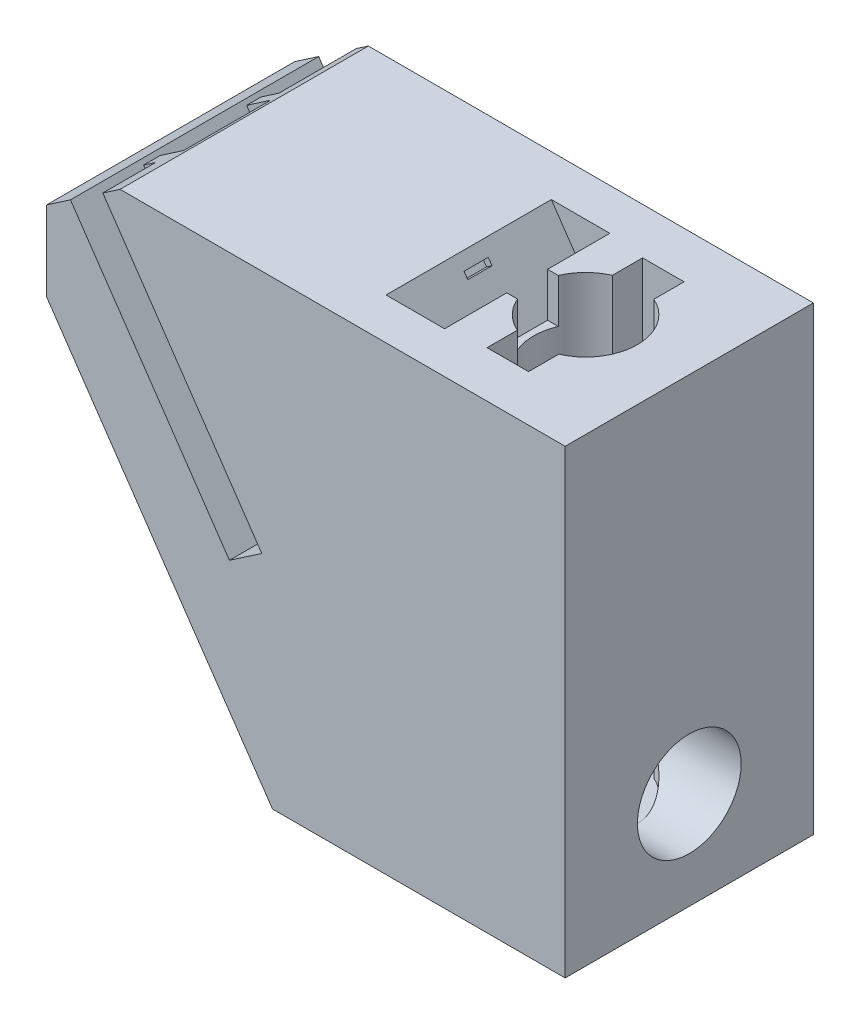
from build123d import *
from build123d.topology import SkipClean

# Parameters (mm, degrees)
BOSS_EXTRUDE1_DEPTH     = 2.5
BOSS_EXTRUDE1_2_DEPTH   = 2.5
BOSS_EXTRUDE2_DEPTH     = 6.35
BOSS_EXTRUDE3_DEPTH     = 6.35
SKETCH4_R               = 3.175
CUT_EXTRUDE1_DEPTH      = 25.4
SKETCH5_R               = 1.5875
CUT_EXTRUDE2_DEPTH      = 25.4
CUT_EXTRUDE3_DEPTH      = 25.4
CUT_EXTRUDE4_REACH      = 43
CUT_EXTRUDE4_END_RADIUS = 3.175
CUT_EXTRUDE5_REACH      = 39.36
SKETCH8_W               = 2.54
SKETCH8_H               = 9.525
SKETCH9_W               = 0.7112
SKETCH9_H               = 15.2
BOSS_EXTRUDE4_DEPTH     = 17
BOSS_EXTRUDE5_DEPTH     = 1.016
SKETCH11_W              = 1.176658287
SKETCH11_H              = 2.5
SKETCH11_W_2            = 2.636987944
SKETCH11_H_2            = 15.2
BOSS_EXTRUDE6_DEPTH     = 1.27
CUT_EXTRUDE6_DEPTH      = 38.864332241
BOSS_EXTRUDE7_START     = 2.54
BOSS_EXTRUDE7_DEPTH     = 2.54
BOSS_EXTRUDE8_DEPTH     = 2.54
BOSS_EXTRUDE9_DEPTH     = 0.508
BOSS_EXTRUDE10_DEPTH    = 0.508
CUT_EXTRUDE7_DEPTH      = 3.81
CUT_EXTRUDE8_DEPTH      = 3.81
BOSS_EXTRUDE11_DEPTH    = 3.81


with BuildPart() as part:
    # Sketch1 → Boss-Extrude1 (new body)
    with BuildSketch(Plane.XY):
        Polygon((5.08, 0), (0, 0), (0, 19.141079028), (-1.033059908, 19.141079028), (-3.75575709, 23.125698967), (-8.376397661, 9.077684872), (-11.679025045, 6.820994294), (-21.26996, 20.857160675), (-22.86, 19.770683798), (-22.86, -3.81), (8.89, -3.81), (8.89, 24.384), (5.08, 24.384), align=None)
    extrude(amount=BOSS_EXTRUDE1_DEPTH)



with BuildPart() as body_2:
    # Sketch1 → Boss-Extrude1 2 (new body)
    with BuildSketch(Plane.XY):
        Polygon((-10.069369191, 23.749), (-4.328956497, 23.964566322), (-4.615556201, 24.384), (-16.108492032, 24.384), (-17.03780348, 23.749), align=None)
    extrude(amount=BOSS_EXTRUDE1_2_DEPTH)


with BuildPart() as part_1:
    add(part.part)

    add(body_2.part)  # Boss-Extrude2 merges body 2
    # Sketch2 → Boss-Extrude2 (add)
    with BuildSketch(Plane.XY.offset(2.5)):
        Polygon((-11.679025045, 6.820994294), (-21.26996, 20.857160675), (-22.86, 19.770683798), (-22.86, -3.81), (8.89, -3.81), (8.89, 24.384), (5.08, 24.384), (5.08, 0), (0, 0), (0, 19.141079028), (-1.033059908, 19.141079028), (-3.75575709, 23.125698967), (-8.376397661, 9.077684872), align=None)
        Polygon((-16.108492032, 24.384), (-18.00931945, 23.085161582), (-8.418384495, 9.048995201), (-8.376397661, 9.077684872), (-3.75575709, 23.125698967), (-1.033059908, 19.141079028), (0, 19.141079028), (0, 0), (5.08, 0), (5.08, 24.384), align=None)
    extrude(amount=BOSS_EXTRUDE2_DEPTH)

    # Sketch3 → Boss-Extrude3 (add)
    with BuildSketch(Plane(origin=(0, 0, 0), x_dir=(-1, 0, 0), z_dir=(0, 0, -1))):
        Polygon((-8.89, 24.384), (-8.89, -3.81), (22.86, -3.81), (22.86, 19.770683798), (21.26996, 20.857160675), (11.679025045, 6.820994294), (8.376397661, 9.077684872), (18.00931945, 23.085161582), (16.108492032, 24.384), align=None)
    extrude(amount=BOSS_EXTRUDE3_DEPTH)

    # Sketch4 → Cut-Extrude1 (cut)
    with BuildSketch(Plane(origin=(0, 24.384, 0), x_dir=(1, 0, 0), z_dir=(0, 1, 0))):
        with Locations(Location((2.54, -1.25, 0), (0, 0, 270))):
            Circle(SKETCH4_R)
    extrude(amount=-CUT_EXTRUDE1_DEPTH, mode=Mode.SUBTRACT)

    # Sketch5 → Cut-Extrude2 (cut)
    with BuildSketch(Plane(origin=(0, -1.016, 0), x_dir=(1, 0, 0), z_dir=(0, 1, 0))):
        with Locations(Location((2.54, -1.25, 0), (0, 0, 270))):
            Circle(SKETCH5_R)
    extrude(amount=-CUT_EXTRUDE2_DEPTH, mode=Mode.SUBTRACT)

    # Sketch6 → Cut-Extrude3 (cut)
    with BuildSketch(Plane.XY.offset(8.85)):
        Polygon((-22.86, 16.430904611), (-9.029357481, -3.81), (-22.86, -3.81), align=None)
    extrude(amount=-CUT_EXTRUDE3_DEPTH, mode=Mode.SUBTRACT)

    # Cut-Extrude4: up to this cylinder (the profile starts outside it)
    with SkipClean():  # the faces are left unmerged after this step: merging them gives an invalid solid
        cut_extrude4_end = Plane(origin=(2.54, 2.159, 1.25), z_dir=(0, 1, 0)) * Cylinder(CUT_EXTRUDE4_END_RADIUS, 96.045024, mode=Mode.PRIVATE)
        # Sketch7 → Cut-Extrude4 (cut, up to the surface)
        with BuildSketch(Plane(origin=(8.89, 0, 0), x_dir=(0, 0, -1), z_dir=(1, 0, 0)), mode=Mode.PRIVATE) as cut_extrude4_sk1:
            with BuildLine():
                ThreePointArc((1.925, 2.159), (-1.25, 5.334), (-4.425, 2.159))
                Line((-4.425, 2.159), (1.925, 2.159))
            make_face()
        cut_extrude4_tool1 = extrude(cut_extrude4_sk1.sketch, amount=-CUT_EXTRUDE4_REACH, mode=Mode.PRIVATE) - cut_extrude4_end
        add(cut_extrude4_tool1.solids().sort_by_distance((8.89, 3.506512, 1.25))[0], mode=Mode.SUBTRACT)
        # Sketch7 → Cut-Extrude4 (cut, up to the surface)
        with BuildSketch(Plane(origin=(8.89, 0, 0), x_dir=(0, 0, -1), z_dir=(1, 0, 0)), mode=Mode.PRIVATE) as cut_extrude4_sk2:
            with BuildLine():
                Line((1.925, 2.159), (-4.425, 2.159))
                ThreePointArc((-4.425, 2.159), (-3.49506403, -0.08606403), (-1.25, -1.016))
                ThreePointArc((-1.25, -1.016), (0.99506403, -0.08606403), (1.925, 2.159))
            make_face()
        cut_extrude4_tool2 = extrude(cut_extrude4_sk2.sketch, amount=-CUT_EXTRUDE4_REACH, mode=Mode.PRIVATE) - cut_extrude4_end
        add(cut_extrude4_tool2.solids().sort_by_distance((8.89, 0.811488, 1.25))[0], mode=Mode.SUBTRACT)
        # Sketch7 → Cut-Extrude4 (cut, up to the surface)
        with BuildSketch(Plane(origin=(8.89, 0, 0), x_dir=(0, 0, -1), z_dir=(1, 0, 0)), mode=Mode.PRIVATE) as cut_extrude4_sk3:
            with BuildLine():
                ThreePointArc((1.925, 2.159), (-1.25, 5.334), (-4.425, 2.159))
                Line((-4.425, 2.159), (1.925, 2.159))
            make_face()
        cut_extrude4_tool3 = extrude(cut_extrude4_sk3.sketch, amount=-CUT_EXTRUDE4_REACH, mode=Mode.PRIVATE) - cut_extrude4_end
        add(cut_extrude4_tool3.solids().sort_by_distance((8.89, 3.506512, 1.25))[0], mode=Mode.SUBTRACT)
        # Sketch7 → Cut-Extrude4 (cut, up to the surface)
        with BuildSketch(Plane(origin=(8.89, 0, 0), x_dir=(0, 0, -1), z_dir=(1, 0, 0)), mode=Mode.PRIVATE) as cut_extrude4_sk4:
            with BuildLine():
                Line((1.925, 2.159), (-4.425, 2.159))
                ThreePointArc((-4.425, 2.159), (-3.49506403, -0.08606403), (-1.25, -1.016))
                ThreePointArc((-1.25, -1.016), (0.99506403, -0.08606403), (1.925, 2.159))
            make_face()
        cut_extrude4_tool4 = extrude(cut_extrude4_sk4.sketch, amount=-CUT_EXTRUDE4_REACH, mode=Mode.PRIVATE) - cut_extrude4_end
        add(cut_extrude4_tool4.solids().sort_by_distance((8.89, 0.811488, 1.25))[0], mode=Mode.SUBTRACT)

    # Cut-Extrude5: up to this face of the body (flat: up to its plane)
    cut_extrude5_end = Plane(part_1.part.faces().sort_by_distance((4.72156403, -1.016, 3.43156403))[0])
    # Sketch8 → Cut-Extrude5 (cut, up to the picked face)
    with BuildSketch(Plane(origin=(0, 24.384, 0), x_dir=(1, 0, 0), z_dir=(0, 1, 0)), mode=Mode.PRIVATE) as cut_extrude5_sk1:
        with Locations((2.54, -1.25)):
            Rectangle(SKETCH8_W, SKETCH8_H)
    cut_extrude5_tool1 = split(extrude(cut_extrude5_sk1.sketch, amount=-CUT_EXTRUDE5_REACH, mode=Mode.PRIVATE), bisect_by=cut_extrude5_end, keep=Keep.BOTH, mode=Mode.PRIVATE)
    add(cut_extrude5_tool1.solids().sort_by(Axis((2.54, 24.384, 1.25), (0, -1, 0)))[0], mode=Mode.SUBTRACT)

    # Sketch9 → Boss-Extrude4 (add)
    with BuildSketch(Plane(origin=(-6.894633763, 10.090176515, 0), x_dir=(0.825656845959394, 0.5641726444275594, 0), z_dir=(-0.5641726444275594, 0.825656845959394, 0))):
        with Locations((-5.439048594, -1.25)):
            Rectangle(SKETCH9_W, SKETCH9_H)
        Polygon((-1.794648594, 6.35), (-2.302648594, 6.35), (-2.302648594, 1.6202), (-3.623501238, 1.6202), (-3.623501238, 0.7312), (-1.794648594, 0.7312), align=None)
        Polygon((-1.845501238, -8.85), (-1.845501238, -4.6028), (-3.572648594, -4.6028), (-3.572648594, -5.6188), (-2.683648594, -5.6188), (-2.683648594, -8.85), align=None)
    extrude(amount=BOSS_EXTRUDE4_DEPTH)

    # Sketch10 → Boss-Extrude5 (add)
    with BuildSketch(Plane(origin=(-6.894633763, 10.090176515, 0), x_dir=(0.8256568459593948, 0.5641726444275585, 0), z_dir=(-0.5641726444275585, 0.8256568459593948, 0))):
        Polygon((-5.083448594, -8.85), (-2.683648594, -8.85), (-2.683648594, -5.6188), (-3.572648594, -5.6188), (-3.572648594, -4.6028), (-1.845501238, -4.6028), (-1.845501238, -2.5), (-1.794648594, -2.5), (-1.794648594, 0), (-1.794648594, 0.7312), (-3.623501238, 0.7312), (-3.623501238, 1.6202), (-2.302648594, 1.6202), (-2.302648594, 6.35), (-5.083448594, 6.35), align=None)
    extrude(amount=BOSS_EXTRUDE5_DEPTH)

    # Sketch11 → Boss-Extrude6 (add)
    with BuildSketch(Plane(origin=(-16.485568719, 24.126342896, 0), x_dir=(0.8256568459593935, 0.5641726444275603, 0), z_dir=(-0.5641726444275603, 0.8256568459593935, 0))):
        with Locations((-1.257172095, -1.25)):
            Rectangle(SKETCH11_W, SKETCH11_H)
        Polygon((-3.623501238, 1.6202), (-3.623501238, 0.7312), (-1.845501238, 0.7312), (-1.845501238, 0), (-0.668842951, 0), (-0.668842951, -2.5), (-1.845501238, -2.5), (-1.845501238, -4.6028), (-3.572648594, -4.6028), (-3.572648594, -5.6188), (-2.683648594, -5.6188), (-2.683648594, -8.85), (0.456699038, -8.85), (0.456699038, 6.35), (-2.302648594, 6.35), (-2.302648594, 1.6202), align=None)
        with Locations((-6.401942566, -1.25)):
            Rectangle(SKETCH11_W_2, SKETCH11_H_2)
    extrude(amount=BOSS_EXTRUDE6_DEPTH)

    # Sketch12 → Cut-Extrude6 (cut, through all)
    with BuildSketch(Plane.XY.offset(8.85)):
        Polygon((-16.108492032, 24.384), (-18.359576008, 24.384), (-16.82499129, 25.432584194), align=None)
        Polygon((-22.86, 19.770683798), (-22.86, 21.308853083), (-23.576499258, 20.819267993), align=None)
    extrude(amount=-CUT_EXTRUDE6_DEPTH, mode=Mode.SUBTRACT)

    # Sketch13 → Boss-Extrude7 (add)
    with BuildSketch(Plane(origin=(0, 19.141079028, 0), x_dir=(1, 0, 0), z_dir=(0, 1, 0)).offset(BOSS_EXTRUDE7_START)):
        with BuildLine():
            Line((-0.378582704, 0), (-1.033059908, 0))
            Line((-1.033059908, 0), (-1.033059908, -2.5))
            Line((-1.033059908, -2.5), (-0.378582704, -2.5))
            ThreePointArc((-0.378582704, -2.5), (-0.635, -1.25), (-0.378582704, 0))
        make_face()
    extrude(amount=-BOSS_EXTRUDE7_DEPTH)

    # Sketch15 → Boss-Extrude8 (add)
    with BuildSketch(Plane.XY):
        Polygon((-4.156996675, 23.712906116), (-4.328956497, 23.964566322), (-4.808856613, 23.946544917), (-4.492543617, 23.483626353), align=None)
        Polygon((-3.75575709, 23.125698967), (-3.927716912, 23.377359173), (-4.263263855, 23.148079411), (-3.915700647, 22.639426706), align=None)
    extrude(amount=BOSS_EXTRUDE8_DEPTH)

    # Sketch16 → Boss-Extrude9 (add)
    with BuildSketch(Plane.XY):
        Polygon((-4.263263855, 23.148079411), (-4.492543617, 23.483626353), (-4.156996675, 23.712906116), (-3.927716912, 23.377359173), align=None)
    extrude(amount=BOSS_EXTRUDE9_DEPTH)

    # Sketch17 → Boss-Extrude10 (add)
    with BuildSketch(Plane(origin=(0, 0, 2.5), x_dir=(-1, 0, 0), z_dir=(0, 0, -1))):
        Polygon((4.263263855, 23.148079411), (4.492543617, 23.483626353), (4.156996675, 23.712906116), (3.927716912, 23.377359173), align=None)
    extrude(amount=BOSS_EXTRUDE10_DEPTH)

    # Sketch18 → Cut-Extrude7 (cut)
    with BuildSketch(Plane(origin=(0, 0, 2.5), x_dir=(-1, 0, 0), z_dir=(0, 0, -1))):
        Polygon((1.033059908, 24.384), (1.033059908, 21.681079028), (1.033059908, 19.141079028), (4.615556201, 24.384), align=None)
    extrude(amount=-CUT_EXTRUDE7_DEPTH, mode=Mode.SUBTRACT)

    # Sketch19 → Cut-Extrude8 (cut)
    with BuildSketch(Plane.XY):
        Polygon((-1.033059908, 19.141079028), (-1.033059908, 21.681079028), (-1.033059908, 24.384), (-4.615556201, 24.384), align=None)
    extrude(amount=-CUT_EXTRUDE8_DEPTH, mode=Mode.SUBTRACT)

    # Sketch20 → Boss-Extrude11 (add)
    with BuildSketch(Plane.XY):
        Polygon((-10.069369191, 23.749), (-4.492543617, 23.483626353), (-4.808856613, 23.946544917), align=None)
    extrude(amount=BOSS_EXTRUDE11_DEPTH)


solid = part_1.part
